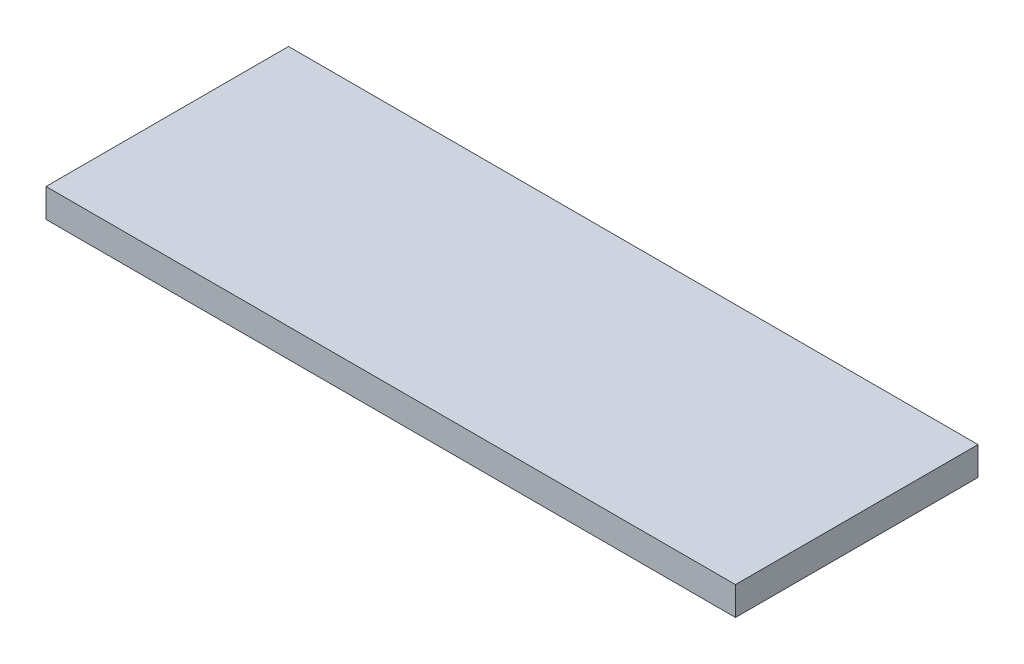
from build123d import *

# Parameters (mm, degrees)
SKETCH_1_W      = 72.5
SKETCH_1_H      = 25.5
EXTRUDE_1_DEPTH = 3


with BuildPart() as part:
    # Эскиз1 → Бобышка-Вытянуть1 (new body)
    with BuildSketch(Plane(origin=(0, 0, 0), x_dir=(1, 0, 0), z_dir=(0, 1, 0))):
        with Locations((36.25, -12.75)):
            Rectangle(SKETCH_1_W, SKETCH_1_H)
    extrude(amount=EXTRUDE_1_DEPTH)


solid = part.part
